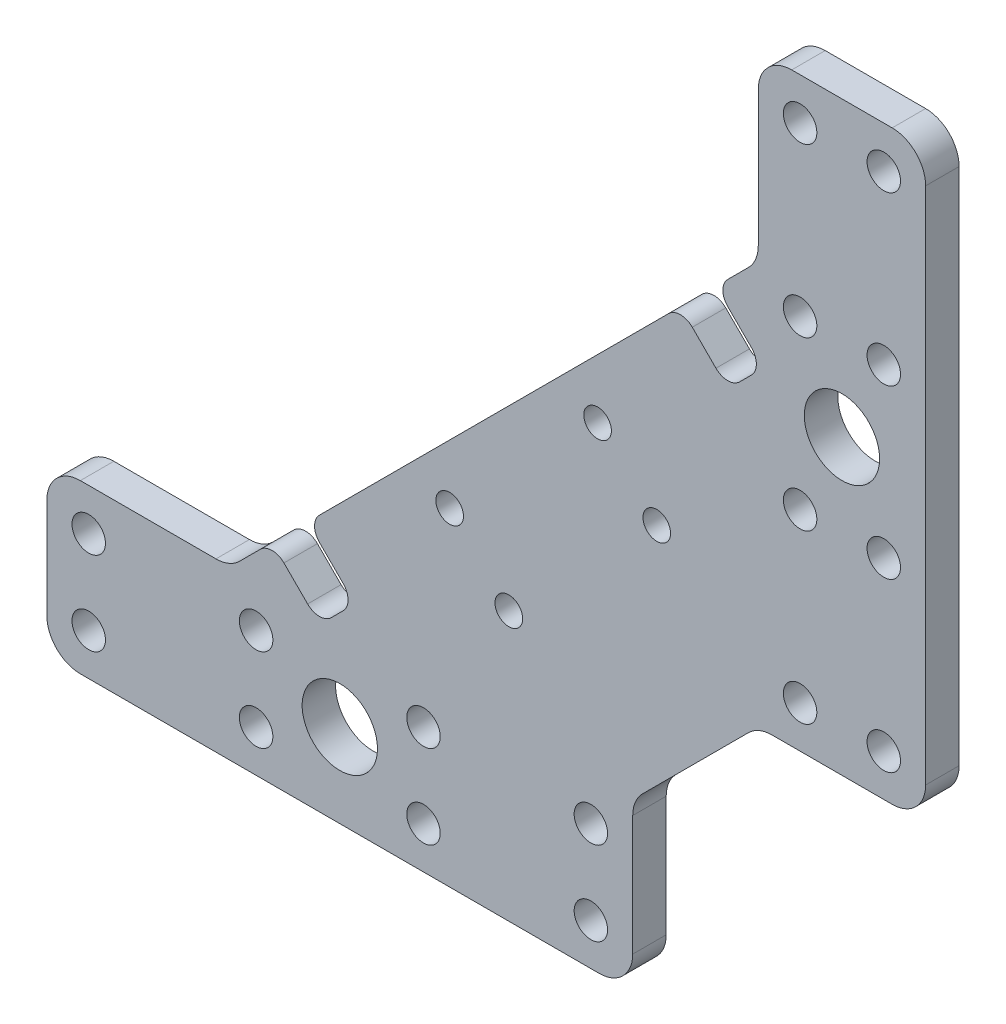
from build123d import *

# Parameters (mm, degrees)
SKETCH_1_R          = 2
SKETCH_1_R_2        = 4.5
SKETCH_1_R_3        = 1.65
EXTRUDE_1_DEPTH     = 4
FILLET_1_R          = 4
CUT_EXTRUDE_1_DEPTH = 10
FILLET_2_R          = 2


with BuildPart() as part:
    # 草图1 → 凸台-拉伸1 (new body)
    # profile 1 of 3: a face of its own
    with BuildSketch(Plane.XY):
        Polygon((-35, 10), (-35, -10), (35, -10), (35, 10), (-13.142135624, 10), align=None)
        with Locations((-30, -5)):
            Circle(SKETCH_1_R, mode=Mode.SUBTRACT)
        with Locations((-10, -5)):
            Circle(SKETCH_1_R, mode=Mode.SUBTRACT)
        with Locations((-30, 5)):
            Circle(SKETCH_1_R, mode=Mode.SUBTRACT)
        with Locations((-10, 5)):
            Circle(SKETCH_1_R, mode=Mode.SUBTRACT)
        Circle(SKETCH_1_R_2, mode=Mode.SUBTRACT)
        with Locations((10, -5)):
            Circle(SKETCH_1_R, mode=Mode.SUBTRACT)
        with Locations((10, 5)):
            Circle(SKETCH_1_R, mode=Mode.SUBTRACT)
        with Locations((30, -5)):
            Circle(SKETCH_1_R, mode=Mode.SUBTRACT)
        with Locations((30, 5)):
            Circle(SKETCH_1_R, mode=Mode.SUBTRACT)
    # profile 2 of 3: a face of its own
    with BuildSketch(Plane.XY):
        Polygon((-13.142135624, 10), (35, 10), (50, 25), (50, 73.142135624), align=None)
        with Locations((13.125631329, 29.196699141)):
            Circle(SKETCH_1_R_3, mode=Mode.SUBTRACT)
        with Locations((20.196699141, 22.125631329)):
            Circle(SKETCH_1_R_3, mode=Mode.SUBTRACT)
        with Locations((37.874368671, 39.803300859)):
            Circle(SKETCH_1_R_3, mode=Mode.SUBTRACT)
        with Locations((30.803300859, 46.874368671)):
            Circle(SKETCH_1_R_3, mode=Mode.SUBTRACT)
    # profile 3 of 3: a face of its own
    with BuildSketch(Plane.XY):
        Polygon((50, 73.142135624), (50, 25), (70, 25), (70, 95), (50, 95), align=None)
        with Locations((55, 30)):
            Circle(SKETCH_1_R, mode=Mode.SUBTRACT)
        with Locations((65, 30)):
            Circle(SKETCH_1_R, mode=Mode.SUBTRACT)
        with Locations((55, 50)):
            Circle(SKETCH_1_R, mode=Mode.SUBTRACT)
        with Locations((65, 50)):
            Circle(SKETCH_1_R, mode=Mode.SUBTRACT)
        with Locations((60, 60)):
            Circle(SKETCH_1_R_2, mode=Mode.SUBTRACT)
        with Locations((55, 70)):
            Circle(SKETCH_1_R, mode=Mode.SUBTRACT)
        with Locations((65, 70)):
            Circle(SKETCH_1_R, mode=Mode.SUBTRACT)
        with Locations((55, 90)):
            Circle(SKETCH_1_R, mode=Mode.SUBTRACT)
        with Locations((65, 90)):
            Circle(SKETCH_1_R, mode=Mode.SUBTRACT)
    extrude(amount=EXTRUDE_1_DEPTH)

    # 圆角1
    fillet_1_edges = [part.edges().sort_by_distance(p)[0] for p in [
        (35, 10, 2),
        (35, -10, 2),
        (-35, -10, 2),
        (-35, 10, 2),
        (-13.142135624, 10, 2),
        (50, 73.142135624, 2),
        (50, 95, 2),
        (70, 95, 2),
        (70, 25, 2),
        (50, 25, 2),
    ]]
    fillet(fillet_1_edges, radius=FILLET_1_R)

    # 草图2 → 切除-拉伸1 (cut)
    with BuildSketch(Plane.XY.offset(4)):
        Polygon((-8.087572106, 15.054563517), (-3.844931419, 19.297204204), (1.81192283, 13.640349955), (-2.430717857, 9.397709268), align=None)
        Polygon((44.945436483, 68.087572106), (40.702795796, 63.844931419), (46.359650045, 58.18807717), (50.602290732, 62.430717857), align=None)
    extrude(amount=-CUT_EXTRUDE_1_DEPTH, mode=Mode.SUBTRACT)

    # 圆角2
    fillet_2_edges = [part.edges().sort_by_distance(p)[0] for p in [
        (-2.430717857, 9.397709268, 2),
        (-8.087572106, 15.054563517, 2),
        (-3.844931419, 19.297204204, 2),
        (1.81192283, 13.640349955, 2),
        (44.945436483, 68.087572106, 2),
        (50.602290732, 62.430717857, 2),
        (46.359650045, 58.18807717, 2),
        (40.702795796, 63.844931419, 2),
    ]]
    fillet(fillet_2_edges, radius=FILLET_2_R)


solid = part.part
